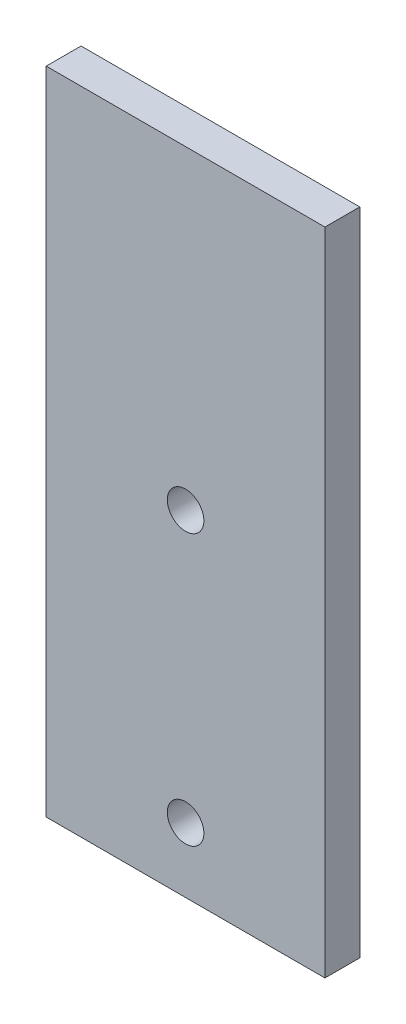
from build123d import *

# Parameters (mm, degrees)
SKETCH1_W           = 38.1
SKETCH1_H           = 88.9
SKETCH1_R           = 2.5
BOSS_EXTRUDE1_DEPTH = 4.7625


with BuildPart() as part:
    # Sketch1 → Boss-Extrude1 (new body)
    with BuildSketch(Plane.XY):
        with Locations((19.05, 44.45)):
            Rectangle(SKETCH1_W, SKETCH1_H)
        with Locations(Location((19.05, 8.85, 0), (0, 0, 180))):
            Circle(SKETCH1_R, mode=Mode.SUBTRACT)
        with Locations(Location((19.05, 45.85, 0), (0, 0, 180))):
            Circle(SKETCH1_R, mode=Mode.SUBTRACT)
    extrude(amount=BOSS_EXTRUDE1_DEPTH)


solid = part.part
